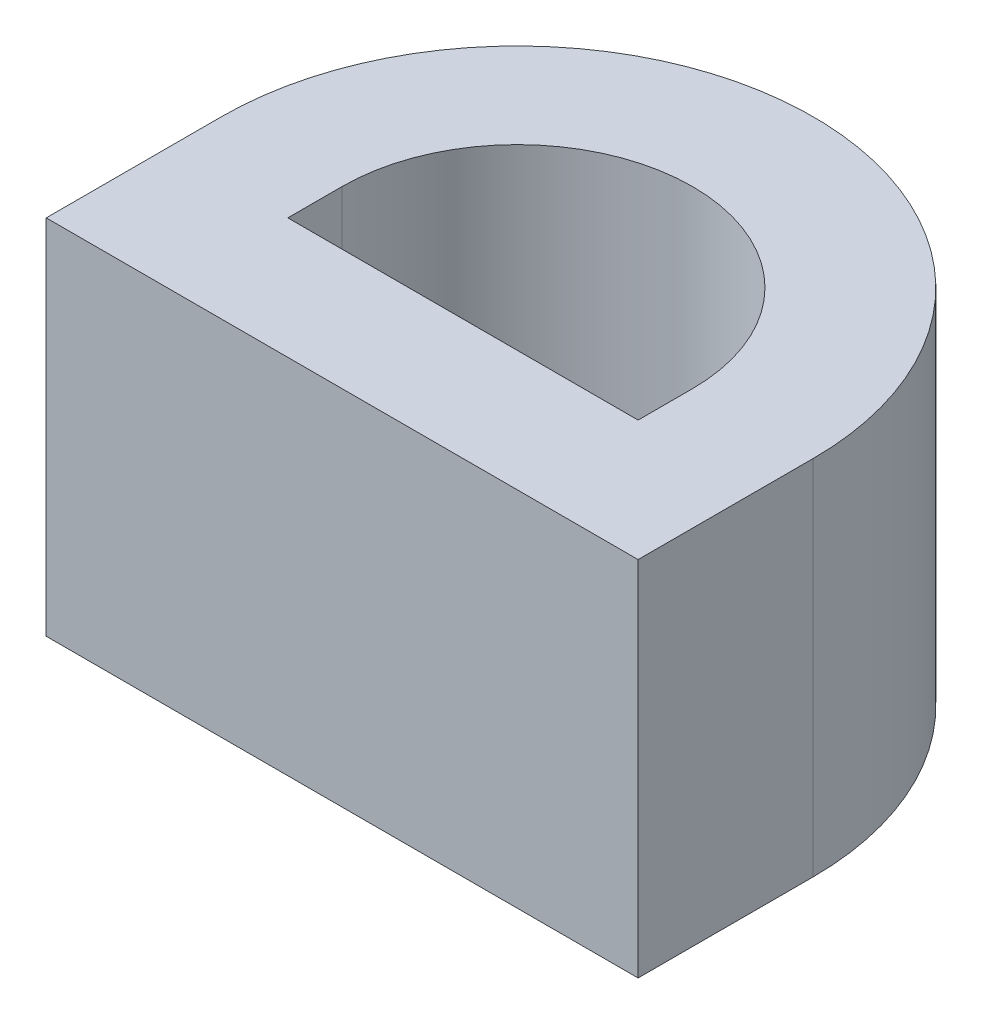
from build123d import *

# Parameters (mm, degrees)
BOSS_EXTRUDE1_DEPTH = 4
BOSS_EXTRUDE2_START = -2
BOSS_EXTRUDE2_DEPTH = 2


with BuildPart() as part:
    # Sketch1 → Boss-Extrude1 (new body)
    with BuildSketch(Plane(origin=(0, 0, 0), x_dir=(1, 0, 0), z_dir=(0, 1, 0))):
        with BuildLine():
            Line((4.9, -2.9), (4.9, 0))
            ThreePointArc((4.9, 0), (0, 4.9), (-4.9, 0))
            Line((-4.9, 0), (-4.9, -2.9))
            Line((-4.9, -2.9), (4.9, -2.9))
        make_face()
        with BuildLine():
            Line((-2.9, -0.9), (-2.9, 0))
            ThreePointArc((-2.9, 0), (0, 2.9), (2.9, 0))
            Line((2.9, 0), (2.9, -0.9))
            Line((2.9, -0.9), (-2.9, -0.9))
        make_face(mode=Mode.SUBTRACT)
    extrude(amount=BOSS_EXTRUDE1_DEPTH)

    # Sketch1<3> → Boss-Extrude2 (add)
    with BuildSketch(Plane(origin=(0, 0, 0), x_dir=(1, 0, 0), z_dir=(0, 1, 0)).offset(BOSS_EXTRUDE2_START)):
        with BuildLine():
            ThreePointArc((4.9, 0), (0, 4.9), (-4.9, 0))
            Line((-4.9, 0), (-4.9, -2.9))
            Line((-4.9, -2.9), (4.9, -2.9))
            Line((4.9, -2.9), (4.9, 0))
        make_face()
    extrude(amount=BOSS_EXTRUDE2_DEPTH)


solid = part.part
